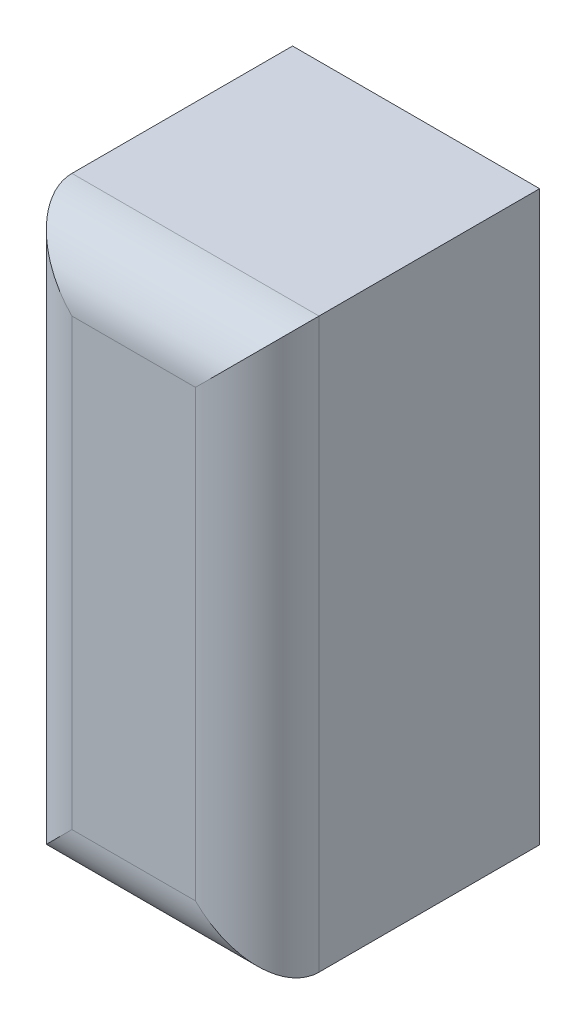
from build123d import *

# Parameters (mm, degrees)
SKETCH1_W           = 20
SKETCH1_H           = 46
BOSS_EXTRUDE1_DEPTH = 22.86
SKETCH2_R           = 6.05
CUT_EXTRUDE1_DEPTH  = 17.78
FILLET1_R           = 5


with BuildPart() as part:
    # Sketch1 → Boss-Extrude1 (new body)
    with BuildSketch(Plane.XY):
        Rectangle(SKETCH1_W, SKETCH1_H)
    extrude(amount=BOSS_EXTRUDE1_DEPTH)

    # Sketch2 → Cut-Extrude1 (cut)
    with BuildSketch(Plane(origin=(0, 0, 0), x_dir=(-1, 0, 0), z_dir=(0, 0, -1))):
        with Locations((0, 12.5)):
            Circle(SKETCH2_R)
        with Locations((0, -12.5)):
            Circle(SKETCH2_R)
    extrude(amount=-CUT_EXTRUDE1_DEPTH, mode=Mode.SUBTRACT)

    # Fillet1
    fillet1_edges = [part.edges().sort_by_distance(p)[0] for p in [
        (-10, 0, 22.86),
        (0, -23, 22.86),
        (10, 0, 22.86),
        (0, 23, 22.86),
    ]]
    fillet(fillet1_edges, radius=FILLET1_R)


solid = part.part
